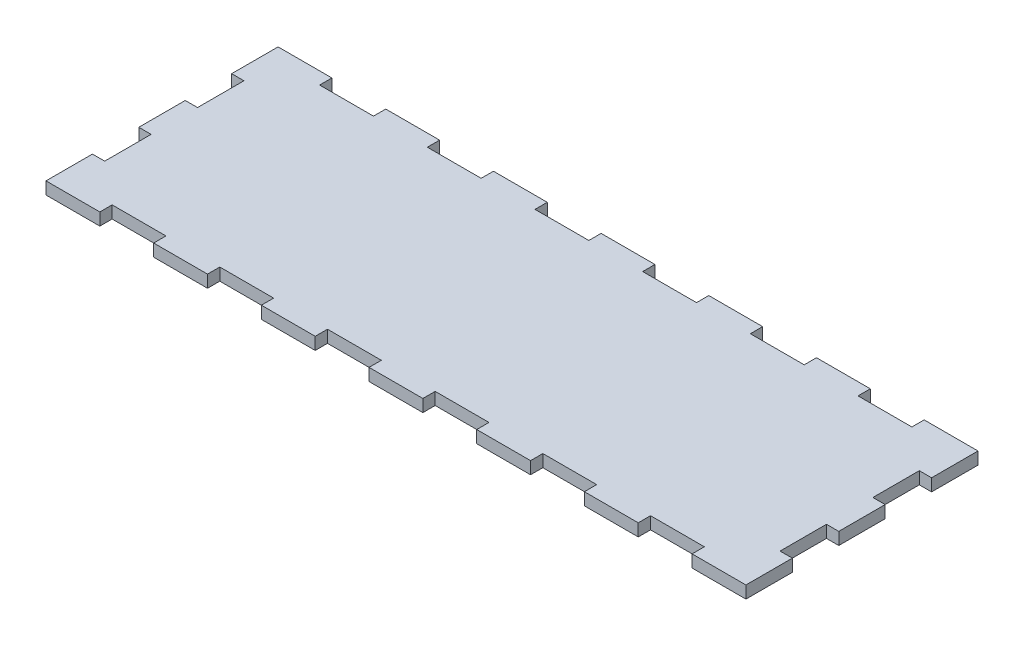
from build123d import *

# Parameters (mm, degrees)
SKETCH1_W           = 144.78
SKETCH1_H           = 48.006
BOSS_EXTRUDE1_DEPTH = 2.54
SKETCH2_OUTSIDE_W   = 177.29
SKETCH2_OUTSIDE_H   = 80.516
CUT_EXTRUDE1_DEPTH  = 2.54


with BuildPart() as part:
    # Sketch1 → Boss-Extrude1 (new body)
    with BuildSketch(Plane(origin=(0, 0, 0), x_dir=(1, 0, 0), z_dir=(0, 1, 0))):
        with Locations((2.921, 0)):
            Rectangle(SKETCH1_W, SKETCH1_H)
    extrude(amount=BOSS_EXTRUDE1_DEPTH)

    # Sketch2 outside → Cut-Extrude1 (cut)
    with BuildSketch(Plane(origin=(0, 2.54, 0), x_dir=(1, 0, 0), z_dir=(0, 1, 0))):
        with Locations((2.921, 0)):
            Rectangle(SKETCH2_OUTSIDE_W, SKETCH2_OUTSIDE_H)
        Polygon((-69.469, 24.003), (-69.469, 14.4018), (-66.929, 14.4018), (-66.929, 4.8006), (-69.469, 4.8006), (-69.469, -4.8006), (-66.929, -4.8006), (-66.929, -14.4018), (-69.469, -14.4018), (-69.469, -24.003), (-58.332076923, -24.003), (-58.332076923, -21.463), (-47.195153846, -21.463), (-47.195153846, -24.003), (-36.058230769, -24.003), (-36.058230769, -21.463), (-24.921307692, -21.463), (-24.921307692, -24.003), (-13.784384615, -24.003), (-13.784384615, -21.463), (-2.647461538, -21.463), (-2.647461538, -24.003), (8.489461538, -24.003), (8.489461538, -21.463), (19.626384615, -21.463), (19.626384615, -24.003), (30.763307692, -24.003), (30.763307692, -21.463), (41.900230769, -21.463), (41.900230769, -24.003), (53.037153846, -24.003), (53.037153846, -21.463), (64.174076923, -21.463), (64.174076923, -24.003), (75.311, -24.003), (75.311, -14.4018), (72.771, -14.4018), (72.771, -4.8006), (75.311, -4.8006), (75.311, 4.8006), (72.771, 4.8006), (72.771, 14.4018), (75.311, 14.4018), (75.311, 24.003), (64.174076923, 24.003), (64.174076923, 21.463), (53.037153846, 21.463), (53.037153846, 24.003), (41.900230769, 24.003), (41.900230769, 21.463), (30.763307692, 21.463), (30.763307692, 24.003), (19.626384615, 24.003), (19.626384615, 21.463), (8.489461538, 21.463), (8.489461538, 24.003), (-2.647461538, 24.003), (-2.647461538, 21.463), (-13.784384615, 21.463), (-13.784384615, 24.003), (-24.921307692, 24.003), (-24.921307692, 21.463), (-36.058230769, 21.463), (-36.058230769, 24.003), (-47.195153846, 24.003), (-47.195153846, 21.463), (-58.332076923, 21.463), (-58.332076923, 24.003), align=None, mode=Mode.SUBTRACT)
    extrude(amount=-CUT_EXTRUDE1_DEPTH, mode=Mode.SUBTRACT)


solid = part.part
